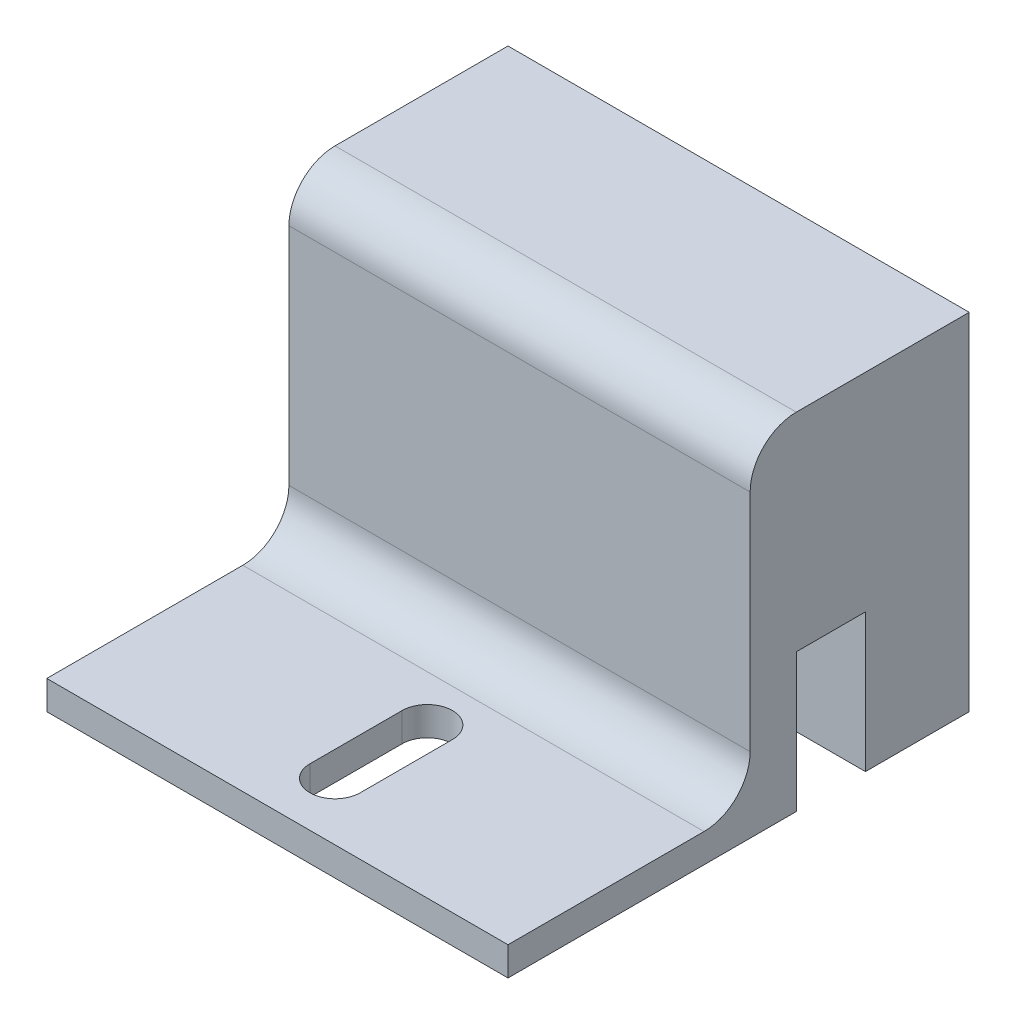
from build123d import *

# Parameters (mm, degrees)
BOSS_EXTRUDE1_DEPTH = 50.8
CUT_EXTRUDE1_DEPTH  = 80.881384721
FILLET1_R           = 5.08


with BuildPart() as part:
    # Sketch1 → Boss-Extrude1 (new body)
    with BuildSketch(Plane(origin=(0, 0, 0), x_dir=(0, 0, -1), z_dir=(1, 0, 0))):
        Polygon((0, 0), (-11.43, 0), (-11.43, 15.24), (-19.05, 15.24), (-19.05, 0), (-50.8, 0), (-50.8, 3.175), (-24.13, 3.175), (-24.13, 38.1), (0, 38.1), align=None)
    extrude(amount=BOSS_EXTRUDE1_DEPTH)

    # Sketch2 → Cut-Extrude1 (cut, through all)
    with BuildSketch(Plane(origin=(0, 3.175, 0), x_dir=(1, 0, 0), z_dir=(0, 1, 0))):
        with BuildLine():
            Line((28.1686, -34.29), (28.1686, -44.45))
            ThreePointArc((28.1686, -44.45), (25.4, -47.2186), (22.6314, -44.45))
            Line((22.6314, -44.45), (22.6314, -34.29))
            ThreePointArc((22.6314, -34.29), (25.4, -31.5214), (28.1686, -34.29))
        make_face()
    extrude(amount=-CUT_EXTRUDE1_DEPTH, mode=Mode.SUBTRACT)

    # Fillet1
    fillet1_edges = [part.edges().sort_by_distance(p)[0] for p in [
        (25.4, 3.175, 24.13),
        (25.4, 38.1, 24.13),
    ]]
    fillet(fillet1_edges, radius=FILLET1_R)


solid = part.part
